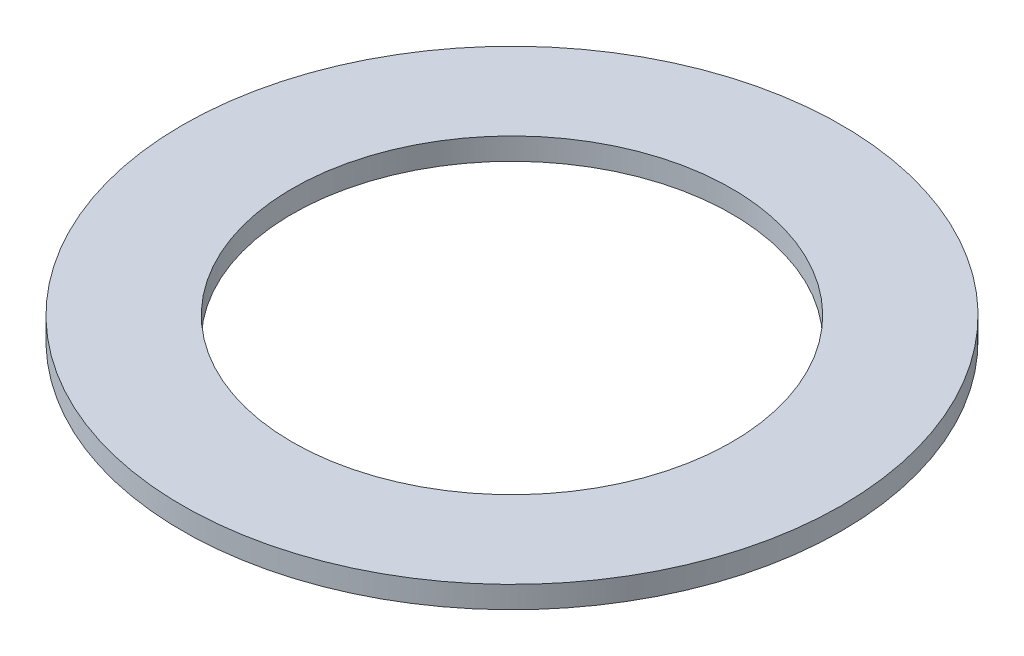
from build123d import *

# Parameters (mm, degrees)
SKETCH1_R           = 15
SKETCH1_R_2         = 10
EXTRUDE_THIN1_DEPTH = 1


with BuildPart() as part:
    # Sketch1 → Extrude-Thin1 (new body)
    with BuildSketch(Plane(origin=(0, 0, 0), x_dir=(1, 0, 0), z_dir=(0, 1, 0))):
        Circle(SKETCH1_R)
        Circle(SKETCH1_R_2, mode=Mode.SUBTRACT)
    extrude(amount=EXTRUDE_THIN1_DEPTH)


solid = part.part
